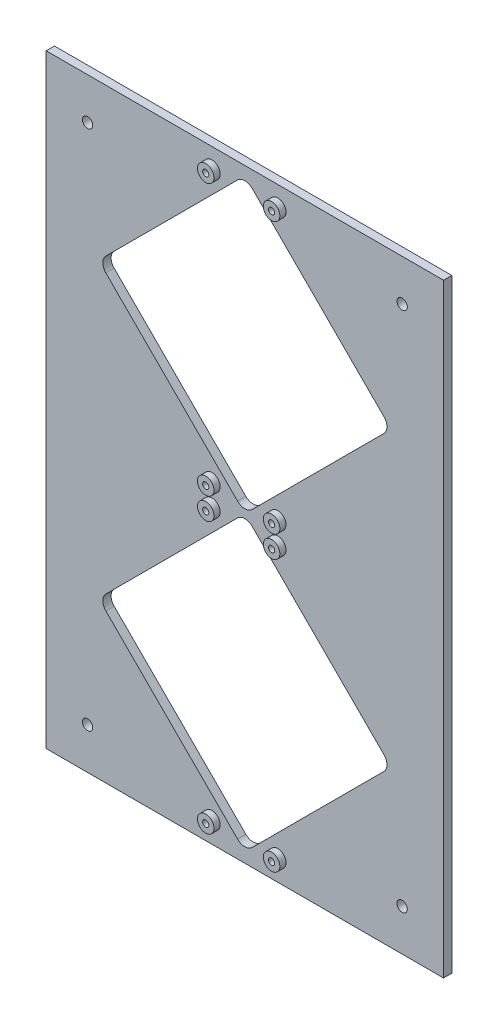
from build123d import *

# Parameters (mm, degrees)
ESQUISSE1_W                          = 192
ESQUISSE1_H                          = 292
BOSS_EXTRU_1_DEPTH                   = 4
ENL_V_MAT_EXTRU_17_DEPTH             = 330.683341579
R_P_TITION_LIN_AIRE2_COUNT           = 2
R_P_TITION_LIN_AIRE2_PITCH           = 141.43
ESQUISSE5_R                          = 4
BOSS_EXTRU_2_DEPTH                   = 3
ESQUISSE6_R                          = 1.5
ENL_V_MAT_EXTRU_18_DEPTH             = 6
ESQUISSE7_R                          = 1.5
ENL_V_MAT_EXTRU_19_DEPTH             = 6
R_P_TITION_LIN_AIRE5_COUNT           = 2
R_P_TITION_LIN_AIRE5_PITCH           = 130.815
ESQUISSE10_R                         = 1.5
ENL_V_MAT_EXTRU_20_DEPTH             = 6
ESQUISSE9_R                          = 4
BOSS_EXTRU_3_DEPTH                   = 3
ESQUISSE11_R                         = 1.5
ENL_V_MAT_EXTRU_21_DEPTH             = 6
R_P_TITION_LIN_AIRE6_COUNT           = 2
R_P_TITION_LIN_AIRE6_PITCH           = 31.82
R_P_TITION_LIN_AIRE7_COUNT           = 2
R_P_TITION_LIN_AIRE7_PITCH           = 130.815
R_P_TITION_LIN_AIRE7_COPY_1_SKETCH_R = 4
R_P_TITION_LIN_AIRE7_COPY_1_DEPTH    = 3
R_P_TITION_LIN_AIRE7_COPY_2_SKETCH_R = 1.5
R_P_TITION_LIN_AIRE7_COPY_2_DEPTH    = 6
ESQUISSE14_R                         = 2.5
ENL_V_MAT_EXTRU_22_DEPTH             = 330.683341579
CONG_2_R                             = 5


with BuildPart() as part:
    # Esquisse1 → Boss.-Extru.1 (new body)
    with BuildSketch(Plane.XY):
        with Locations((77.321557543, 134.418871343)):
            Rectangle(ESQUISSE1_W, ESQUISSE1_H)
    extrude(amount=BOSS_EXTRU_1_DEPTH)

    # Esquisse4 → Enlèv. mat.-Extru.17 (cut, through all)
    with BuildSketch(Plane.XY.offset(4)):
        Polygon((77.321557543, 276.118871343), (6.610879425, 205.408193225), (77.321557543, 134.697515106), (148.032235662, 205.408193225), align=None)
    enl_v_mat_extru_17 = extrude(amount=-ENL_V_MAT_EXTRU_17_DEPTH, mode=Mode.SUBTRACT)

    # Répétition linéaire2: Enlèv. mat.-Extru.17 ×2
    with Locations(*[(0, -i * R_P_TITION_LIN_AIRE2_PITCH, 0) for i in range(1, R_P_TITION_LIN_AIRE2_COUNT)]):
        add(enl_v_mat_extru_17, mode=Mode.SUBTRACT)

    # Esquisse5 → Boss.-Extru.2 (add)
    with BuildSketch(Plane.XY.offset(4)):
        with Locations(Location((61.411654967, 270.815570484, 0), (0, 0, 180))):
            Circle(ESQUISSE5_R)
        with Locations(Location((93.23146012, 270.815570484, 0), (0, 0, 180))):
            Circle(ESQUISSE5_R)
    boss_extru_2 = extrude(amount=BOSS_EXTRU_2_DEPTH)

    # Esquisse6 → Enlèv. mat.-Extru.18 (cut)
    with BuildSketch(Plane.XY.offset(7)):
        with Locations((61.411654967, 270.815570484)):
            Circle(ESQUISSE6_R)
    enl_v_mat_extru_18 = extrude(amount=-ENL_V_MAT_EXTRU_18_DEPTH, mode=Mode.SUBTRACT)

    # Esquisse7 → Enlèv. mat.-Extru.19 (cut)
    with BuildSketch(Plane.XY.offset(7)):
        with Locations((93.23146012, 270.815570484)):
            Circle(ESQUISSE7_R)
    extrude(amount=-ENL_V_MAT_EXTRU_19_DEPTH, mode=Mode.SUBTRACT)

    # Répétition linéaire5: Boss.-Extru.2, Enlèv. mat.-Extru.18 ×2
    with Locations(*[(0, -i * R_P_TITION_LIN_AIRE5_PITCH, 0) for i in range(1, R_P_TITION_LIN_AIRE5_COUNT)]):
        add(boss_extru_2)
        add(enl_v_mat_extru_18, mode=Mode.SUBTRACT)

    # Esquisse10 → Enlèv. mat.-Extru.20 (cut)
    with BuildSketch(Plane.XY.offset(7)):
        with Locations((93.23146012, 140.000570484)):
            Circle(ESQUISSE10_R)
    extrude(amount=-ENL_V_MAT_EXTRU_20_DEPTH, mode=Mode.SUBTRACT)

    # Esquisse9 → Boss.-Extru.3 (add)
    with BuildSketch(Plane.XY.offset(4)):
        with Locations(Location((93.23146012, 129.385570484, 0), (0, 0, 180))):
            Circle(ESQUISSE9_R)
    boss_extru_3 = extrude(amount=BOSS_EXTRU_3_DEPTH)

    # Esquisse11 → Enlèv. mat.-Extru.21 (cut)
    with BuildSketch(Plane.XY.offset(7)):
        with Locations((93.23146012, 129.385570484)):
            Circle(ESQUISSE11_R)
    enl_v_mat_extru_21 = extrude(amount=-ENL_V_MAT_EXTRU_21_DEPTH, mode=Mode.SUBTRACT)

    # Répétition linéaire6: Boss.-Extru.3, Enlèv. mat.-Extru.21 ×2
    with Locations(*[(-i * R_P_TITION_LIN_AIRE6_PITCH, 0, 0) for i in range(1, R_P_TITION_LIN_AIRE6_COUNT)]):
        add(boss_extru_3)
        add(enl_v_mat_extru_21, mode=Mode.SUBTRACT)

    # Répétition linéaire7: Boss.-Extru.3, Enlèv. mat.-Extru.21 ×2
    with Locations(*[(0, -i * R_P_TITION_LIN_AIRE7_PITCH, 0) for i in range(1, R_P_TITION_LIN_AIRE7_COUNT)]):
        add(boss_extru_3)
        add(enl_v_mat_extru_21, mode=Mode.SUBTRACT)

    # Répétition linéaire7 copy 1 sketch → Répétition linéaire7 copy 1 (add)
    with BuildSketch(Plane(origin=(-31.82, -130.815, 4), x_dir=(1, 0, 0), z_dir=(0, 0, 1))):
        with Locations(Location((93.23146012, 129.385570484, 0), (0, 0, 180))):
            Circle(R_P_TITION_LIN_AIRE7_COPY_1_SKETCH_R)
    extrude(amount=R_P_TITION_LIN_AIRE7_COPY_1_DEPTH)

    # Répétition linéaire7 copy 2 sketch → Répétition linéaire7 copy 2 (cut)
    with BuildSketch(Plane(origin=(-31.82, -130.815, 7), x_dir=(1, 0, 0), z_dir=(0, 0, 1))):
        with Locations((93.23146012, 129.385570484)):
            Circle(R_P_TITION_LIN_AIRE7_COPY_2_SKETCH_R)
    extrude(amount=-R_P_TITION_LIN_AIRE7_COPY_2_DEPTH, mode=Mode.SUBTRACT)

    # Esquisse14 → Enlèv. mat.-Extru.22 (cut, through all)
    with BuildSketch(Plane.XY.offset(4)):
        with Locations((1.321557543, 8.418871343)):
            Circle(ESQUISSE14_R)
        with Locations((153.321557543, 8.418871343)):
            Circle(ESQUISSE14_R)
        with Locations((153.321557543, 260.418871343)):
            Circle(ESQUISSE14_R)
        with Locations((1.321557543, 260.418871343)):
            Circle(ESQUISSE14_R)
    extrude(amount=-ENL_V_MAT_EXTRU_22_DEPTH, mode=Mode.SUBTRACT)

    # Congé2
    cong_2_edges = [part.edges().sort_by_distance(p)[0] for p in [
        (6.610879425, 205.408193225, 2),
        (77.321557543, 276.118871343, 2),
        (148.032235662, 205.408193225, 2),
        (77.321557543, 134.697515106, 2),
        (6.610879425, 63.978193225, 2),
        (77.321557543, 134.688871343, 2),
        (148.032235662, 63.978193225, 2),
        (77.321557543, -6.732484894, 2),
    ]]
    fillet(cong_2_edges, radius=CONG_2_R)


solid = part.part
